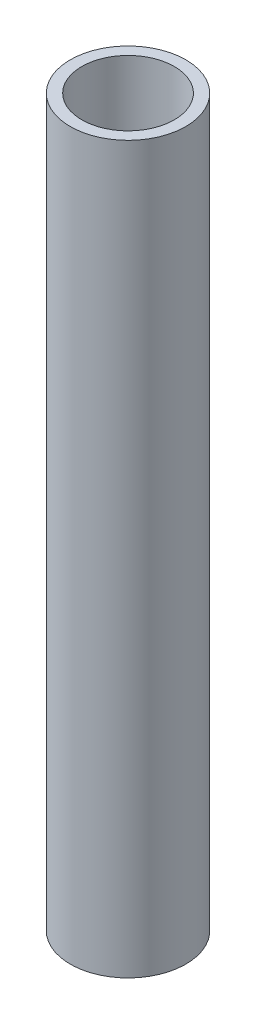
from build123d import *

# Parameters (mm, degrees)
SKETCH1_R           = 15
SKETCH1_R_2         = 12
BOSS_EXTRUDE1_DEPTH = 188.23


with BuildPart() as part:
    # Sketch1 → Boss-Extrude1 (new body)
    with BuildSketch(Plane(origin=(0, 0, 0), x_dir=(1, 0, 0), z_dir=(0, 1, 0))):
        with Locations(Location((0, 0, 0), (0, 0, 90))):
            Circle(SKETCH1_R)
        with Locations(Location((0, 0, 0), (0, 0, 90))):
            Circle(SKETCH1_R_2, mode=Mode.SUBTRACT)
    extrude(amount=BOSS_EXTRUDE1_DEPTH)


solid = part.part
